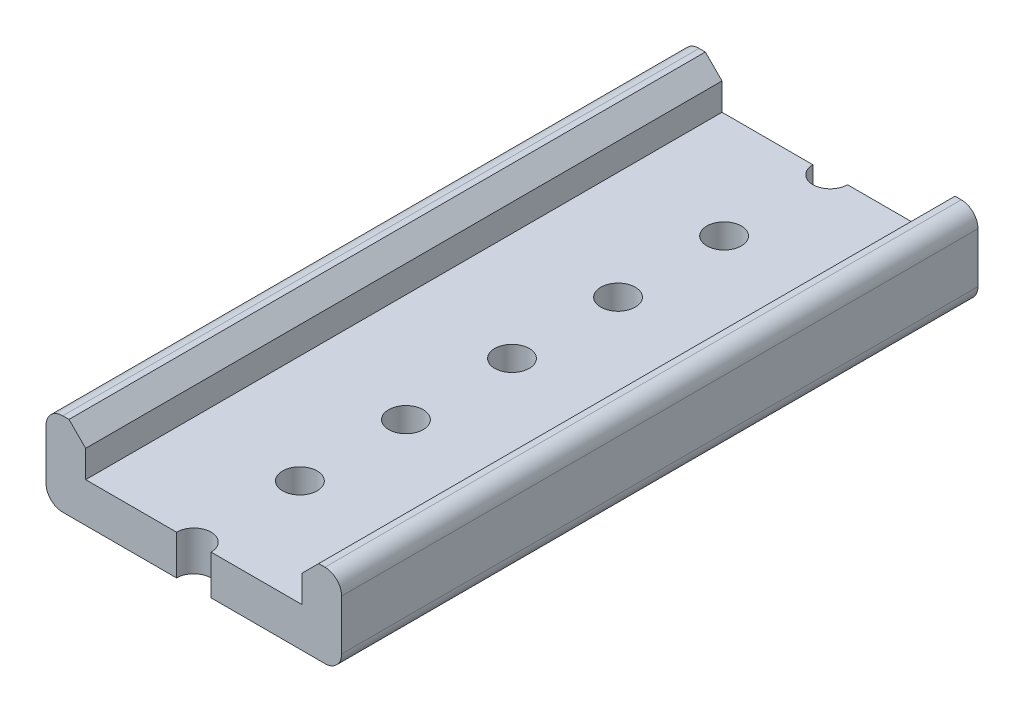
from build123d import *

# Parameters (mm, degrees)
BOSS_EXTRUDE1_DEPTH     = 38.1
CUT_EXTRUDE1_DEPTH      = 43.337483392
CUT_EXTRUDE1_DEPTH_BACK = 43.337483392
SKETCH2_R               = 2.07
CHAMFER1_SIZE           = 2
FILLET1_R               = 2


with BuildPart() as part:
    # Sketch1 → Boss-Extrude1 (new, symmetric)
    with BuildSketch(Plane.XY):
        Polygon((-17.7, -7.7), (-17.7, -17.7), (17.7, -17.7), (17.7, -7.7), (12.95, -7.7), (12.95, -12.95), (-12.95, -12.95), (-12.95, -7.7), align=None)
    extrude(amount=BOSS_EXTRUDE1_DEPTH, both=True)

    # Sketch2 → Cut-Extrude1 (cut, two sides: drawn at the far end of the back side and taken through both)
    with BuildSketch(Plane(origin=(0, -12.95, 0), x_dir=(1, 0, 0), z_dir=(0, 1, 0)).offset(-CUT_EXTRUDE1_DEPTH_BACK)):
        with Locations(Location((0, 25.4, 0), (0, 0, 270))):
            Circle(SKETCH2_R)
        with Locations(Location((0, 12.7, 0), (0, 0, 270))):
            Circle(SKETCH2_R)
        with Locations(Location((0, 0, 0), (0, 0, 270))):
            Circle(SKETCH2_R)
        with Locations(Location((0, -12.7, 0), (0, 0, 270))):
            Circle(SKETCH2_R)
        with Locations(Location((0, -25.4, 0), (0, 0, 270))):
            Circle(SKETCH2_R)
        with Locations((0, -38.1)):
            Circle(SKETCH2_R)
        with Locations((0, 38.1)):
            Circle(SKETCH2_R)
    extrude(amount=CUT_EXTRUDE1_DEPTH + CUT_EXTRUDE1_DEPTH_BACK, mode=Mode.SUBTRACT)

    # Chamfer1
    chamfer1_edges = [part.edges().sort_by_distance(p)[0] for p in [
        (-12.95, -7.7, 0),
        (12.95, -7.7, 0),
    ]]
    chamfer(chamfer1_edges, length=CHAMFER1_SIZE)

    # Fillet1
    fillet1_edges = [part.edges().sort_by_distance(p)[0] for p in [
        (-17.7, -17.7, 0),
        (-17.7, -7.7, 0),
        (17.7, -7.7, 0),
        (17.7, -17.7, 0),
    ]]
    fillet(fillet1_edges, radius=FILLET1_R)


solid = part.part
